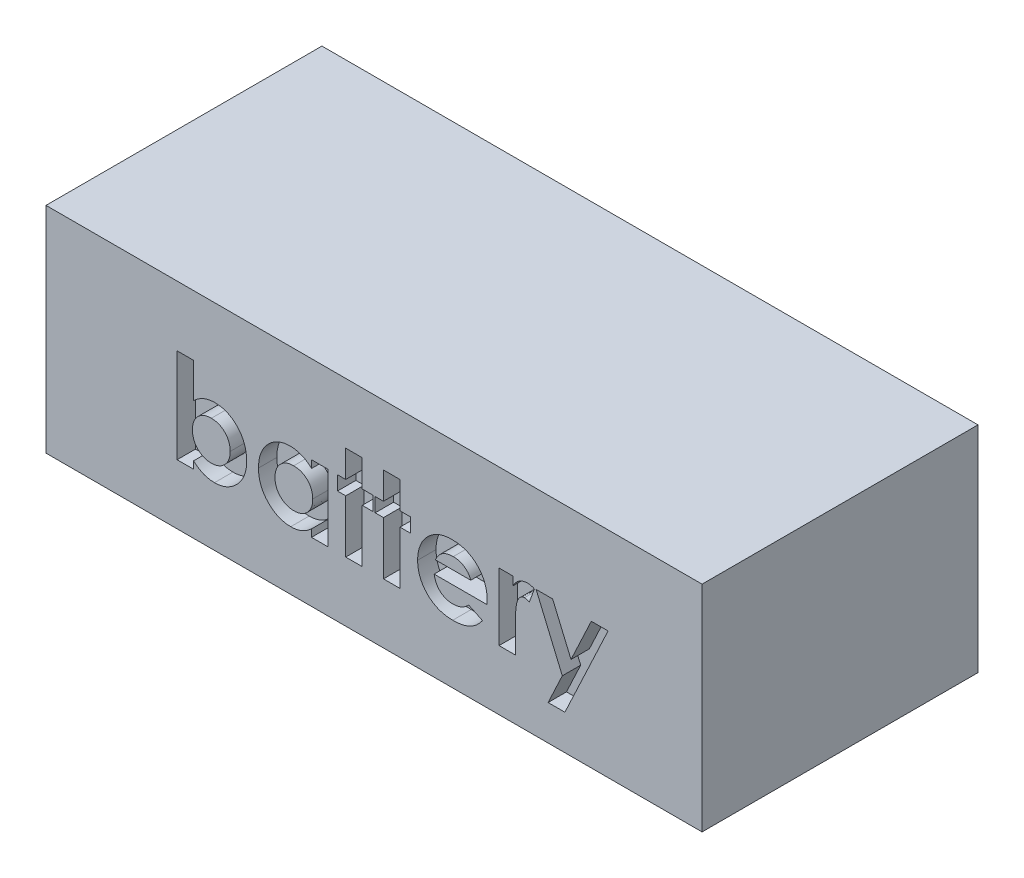
from build123d import *

# Parameters (mm, degrees)
SKETCH_1_W          = 107
SKETCH_1_H          = 35
EXTRUDE_1_DEPTH     = 45
CUT_EXTRUDE_1_DEPTH = 3


with BuildPart() as part:
    # ｽｹｯﾁ1 → ﾎﾞｽ - 押し出し1 (new body)
    with BuildSketch(Plane.XY):
        with Locations((53.5, 17.5)):
            Rectangle(SKETCH_1_W, SKETCH_1_H)
    extrude(amount=EXTRUDE_1_DEPTH)

    # ｽｹｯﾁ2 → ｶｯﾄ - 押し出し1 (cut)
    # profile 1 of 7: a face of its own
    with BuildSketch(Plane.XY.offset(45)):
        with BuildLine():
            Line((24.074722229, 25.14774532), (24.074722229, 19.447625128))
            add(Edge.make_bspline(
                [(24.074722229, 19.447625128), (24.199740685, 19.565337539), (24.445158571, 19.79641327), (24.845857096, 20.095219483), (25.260933041, 20.347409477), (25.690014561, 20.558985084), (26.136963428, 20.715436123), (26.596288067, 20.837004441), (27.072695046, 20.901389585), (27.394868954, 20.911751888), (27.557294345, 20.916976089)],
                knots=[0, 0, 0, 0, 1.061187343, 2.083167259, 3.083809127, 4.061667593, 5.035358583, 6.007314429, 6.995378812, 8, 8, 8, 8], degree=3))
            add(Edge.make_bspline(
                [(27.557294345, 20.916976089), (27.733852947, 20.912747065), (28.081616104, 20.904417261), (28.59328342, 20.826646571), (29.083624154, 20.700935602), (29.554508103, 20.525408828), (30.00342645, 20.297516625), (30.435423114, 20.024658742), (30.843047804, 19.695575564), (31.226498678, 19.322833687), (31.581200289, 18.914280901), (31.889725368, 18.470097312), (32.146714786, 17.996129229), (32.364525944, 17.497979945), (32.523493276, 16.967387819), (32.646012031, 16.41147039), (32.714286357, 15.825524477), (32.723746, 15.426355734), (32.728568383, 15.222865512)],
                knots=[0, 0, 0, 0, 0.985987466, 1.942075377, 2.884088208, 3.810275091, 4.743821533, 5.692411115, 6.659945104, 7.665215984, 8.677116751, 9.678438675, 10.680260931, 11.685531812, 12.710472044, 13.769734641, 14.863044265, 16, 16, 16, 16], degree=3))
            add(Edge.make_bspline(
                [(32.728568383, 15.222865512), (32.724004319, 15.026341303), (32.715007541, 14.638948756), (32.642319248, 14.07022462), (32.519118679, 13.526931847), (32.346293248, 13.008874775), (32.126585563, 12.514416254), (31.858417169, 12.043896993), (31.540223782, 11.598960505), (31.176446629, 11.185600535), (30.778967225, 10.811272353), (30.364822177, 10.47542555), (29.925763077, 10.200225432), (29.472765421, 9.967797849), (28.99869278, 9.790064974), (28.506783278, 9.665543118), (27.997815979, 9.582292533), (27.651780207, 9.574683754), (27.476164537, 9.570822243)],
                knots=[0, 0, 0, 0, 1.098553145, 2.165490463, 3.199345634, 4.208780719, 5.21409072, 6.219899742, 7.23156933, 8.267303578, 9.293302409, 10.281606823, 11.243293419, 12.184993323, 13.124258899, 14.066907486, 15.018941492, 16, 16, 16, 16], degree=3))
            add(Edge.make_bspline(
                [(27.476164537, 9.570822243), (27.319730468, 9.575004139), (27.011700412, 9.583238596), (26.557651289, 9.644311662), (26.121326568, 9.747024792), (25.697214428, 9.888512791), (25.284164117, 10.081826998), (24.874982354, 10.323541124), (24.467035734, 10.616713412), (24.208125782, 10.842636401), (24.074722229, 10.959043397)],
                knots=[0, 0, 0, 0, 0.996418773, 1.962021009, 2.912343664, 3.848616743, 4.805003894, 5.811808768, 6.872532775, 8, 8, 8, 8], degree=3))
            Line((24.074722229, 10.959043397), (24.074722229, 9.763129935))
            Line((24.074722229, 9.763129935), (21.382414537, 9.763129935))
            Line((21.382414537, 9.763129935), (21.382414537, 25.14774532))
            Line((21.382414537, 25.14774532), (24.074722229, 25.14774532))
        make_face()
        with BuildLine():
            add(Edge.make_bspline(
                [(26.974361653, 18.416976089), (26.865099774, 18.413616211), (26.650887096, 18.407029024), (26.33638387, 18.369277884), (26.038386525, 18.298248837), (25.752364254, 18.20618792), (25.481938922, 18.081920142), (25.224898143, 17.931282049), (24.983443495, 17.751657623), (24.756321835, 17.550159769), (24.552234967, 17.323474304), (24.370921489, 17.081249127), (24.220497806, 16.820330011), (24.095103271, 16.544025378), (24.000498573, 16.249345641), (23.930329296, 15.938797645), (23.892196742, 15.611429699), (23.885726844, 15.388220613), (23.882414537, 15.273947243)],
                knots=[0, 0, 0, 0, 1.060469436, 2.079096586, 3.066888298, 4.028858836, 4.99004353, 5.948472697, 6.914558426, 7.905691313, 8.889602648, 9.869280844, 10.836099585, 11.806137001, 12.808075328, 13.83377171, 14.890985086, 16, 16, 16, 16], degree=3))
            add(Edge.make_bspline(
                [(23.882414537, 15.273947243), (23.885768523, 15.157673996), (23.892350864, 14.929482742), (23.930165535, 14.595134114), (23.999842295, 14.278364407), (24.096439546, 13.978455425), (24.219700324, 13.695368255), (24.369945783, 13.428053453), (24.553255054, 13.182371758), (24.755099952, 12.949709575), (24.983625962, 12.745515637), (25.223992851, 12.562381763), (25.481876475, 12.411519127), (25.753594179, 12.289284732), (26.037084193, 12.187708619), (26.336571059, 12.119073744), (26.650837426, 12.080622492), (26.865082997, 12.07413253), (26.974361653, 12.070822243)],
                knots=[0, 0, 0, 0, 1.117193555, 2.192540452, 3.22680955, 4.227918444, 5.21468246, 6.188555072, 7.166222992, 8.154674427, 9.142376254, 10.104580718, 11.053462639, 12.005072638, 12.963662044, 13.941614018, 14.950094269, 16, 16, 16, 16], degree=3))
            add(Edge.make_bspline(
                [(26.974361653, 12.070822243), (27.079665331, 12.073897398), (27.288106209, 12.079984442), (27.593090526, 12.122457697), (27.886256438, 12.191863216), (28.165308067, 12.290791188), (28.43194411, 12.419595308), (28.688591945, 12.570317446), (28.926391124, 12.758633506), (29.154670906, 12.965608932), (29.358920323, 13.199017685), (29.542156597, 13.446983743), (29.696080512, 13.711720254), (29.818292473, 13.994105123), (29.919328586, 14.28878957), (29.988309127, 14.60116734), (30.026260957, 14.928450238), (30.032894331, 15.151657649), (30.036260691, 15.26493282)],
                knots=[0, 0, 0, 0, 1.021711385, 2.02240246, 2.981887075, 3.941027022, 4.888772411, 5.852236371, 6.822344989, 7.82661704, 8.838806642, 9.826383926, 10.814965113, 11.80282933, 12.807900643, 13.833672313, 14.900613836, 16, 16, 16, 16], degree=3))
            add(Edge.make_bspline(
                [(30.036260691, 15.26493282), (30.032840572, 15.377188896), (30.026101979, 15.598364795), (29.988927322, 15.922922302), (29.917290925, 16.230758637), (29.826840855, 16.524388597), (29.700473999, 16.799989885), (29.551057934, 17.060822821), (29.37524225, 17.30767497), (29.171288482, 17.533882533), (28.947587146, 17.739715164), (28.708789779, 17.921775824), (28.455834161, 18.076761318), (28.185275591, 18.198984936), (27.903498823, 18.299548632), (27.606197721, 18.368818236), (27.294883736, 18.40715591), (27.082637311, 18.413658731), (26.974361653, 18.416976089)],
                knots=[0, 0, 0, 0, 1.094680664, 2.156827393, 3.177782763, 4.17210342, 5.146667393, 6.126451192, 7.099203661, 8.094961544, 9.09004898, 10.058676268, 11.018205477, 11.974998356, 12.947750825, 13.930643515, 14.944335875, 16, 16, 16, 16], degree=3))
        make_face(mode=Mode.SUBTRACT)
    # profile 2 of 7: a face of its own
    with BuildSketch(Plane.XY.offset(45)):
        with BuildLine():
            Line((43.30549146, 20.724668397), (45.997799153, 20.724668397))
            Line((45.997799153, 20.724668397), (45.997799153, 9.763129935))
            Line((45.997799153, 9.763129935), (43.30549146, 9.763129935))
            Line((43.30549146, 9.763129935), (43.30549146, 10.959043397))
            add(Edge.make_bspline(
                [(43.30549146, 10.959043397), (43.172088606, 10.842634457), (42.91318001, 10.616707694), (42.505223842, 10.323561975), (42.096075578, 10.081754643), (41.683769251, 9.88916829), (41.261967884, 9.74696309), (40.827634678, 9.644003204), (40.374514772, 9.58328524), (40.066490102, 9.575019849), (39.910058768, 9.570822243)],
                knots=[0, 0, 0, 0, 1.129196829, 2.191548051, 3.199897424, 4.157751732, 5.089409408, 6.034969131, 7.002052659, 8, 8, 8, 8], degree=3))
            add(Edge.make_bspline(
                [(39.910058768, 9.570822243), (39.734457642, 9.574772719), (39.387459864, 9.582579084), (38.878279148, 9.664753667), (38.386614546, 9.790540183), (37.912865152, 9.968543825), (37.457892911, 10.199201648), (37.018215905, 10.476495468), (36.601371537, 10.810159956), (36.203889722, 11.1857583), (35.839957755, 11.598919151), (35.521804995, 12.043907893), (35.253625863, 12.514413342), (35.033921051, 13.008875558), (34.861094844, 13.526931632), (34.737894488, 14.07022468), (34.665206137, 14.638948741), (34.656209367, 15.026341298), (34.651645306, 15.222865512)],
                knots=[0, 0, 0, 0, 0.980476535, 1.937477201, 2.874147792, 3.812856188, 4.758993464, 5.720109578, 6.712210464, 7.737600662, 8.772720504, 9.783789959, 10.789002326, 11.793715968, 12.802552247, 13.835794126, 14.902098527, 16, 16, 16, 16], degree=3))
            add(Edge.make_bspline(
                [(34.651645306, 15.222865512), (34.656435305, 15.426366594), (34.665831421, 15.825556642), (34.734563449, 16.411349057), (34.855490294, 16.968113012), (35.02038274, 17.496619706), (35.23248824, 17.996960444), (35.490818566, 18.469954945), (35.798888061, 18.914366876), (36.153883542, 19.322632035), (36.537191469, 19.696826773), (36.947263189, 20.022592967), (37.377686076, 20.299346506), (37.82891753, 20.525284794), (38.300893112, 20.699878468), (38.791749471, 20.827520701), (39.303665663, 20.904110523), (39.652387121, 20.912651952), (39.82892896, 20.916976089)],
                knots=[0, 0, 0, 0, 1.136281865, 2.228943489, 3.287578264, 4.313574083, 5.316051562, 6.317280042, 7.318008486, 8.329309503, 9.333984563, 10.305318864, 11.248632312, 12.186624717, 13.117503092, 14.05354244, 15.014596925, 16, 16, 16, 16], degree=3))
            add(Edge.make_bspline(
                [(39.82892896, 20.916976089), (39.992463906, 20.913578616), (40.316040619, 20.906856243), (40.791651764, 20.833864127), (41.252925978, 20.723468735), (41.697346987, 20.566175173), (42.128560078, 20.367560051), (42.539148116, 20.118680498), (42.938093084, 19.829996812), (43.18151224, 19.604528738), (43.30549146, 19.489692435)],
                knots=[0, 0, 0, 0, 1.017011718, 2.012299608, 2.98747302, 3.965332399, 4.941441765, 5.936729654, 6.94912688, 8, 8, 8, 8], degree=3))
            Line((43.30549146, 19.489692435), (43.30549146, 20.724668397))
        make_face()
        with BuildLine():
            add(Edge.make_bspline(
                [(40.393832806, 18.416976089), (40.286552281, 18.413684352), (40.076289457, 18.407232763), (39.767069199, 18.368426004), (39.471547394, 18.300046764), (39.191831682, 18.199031122), (38.923753269, 18.075979352), (38.671382969, 17.921859035), (38.432637894, 17.739692096), (38.208922127, 17.533888793), (38.004972244, 17.307673336), (37.829155541, 17.060823258), (37.679739748, 16.799989768), (37.553372819, 16.524388629), (37.462922769, 16.230758628), (37.391286367, 15.922922305), (37.354111711, 15.598364794), (37.347373118, 15.377188896), (37.343952999, 15.26493282)],
                knots=[0, 0, 0, 0, 1.04836806, 2.054732945, 3.03993516, 4.00574415, 4.955904794, 5.917688631, 6.888591924, 7.88601754, 8.884115178, 9.859153345, 10.841239365, 11.818093293, 12.814750328, 13.83810466, 14.90274714, 16, 16, 16, 16], degree=3))
            add(Edge.make_bspline(
                [(37.343952999, 15.26493282), (37.347320875, 15.151658516), (37.353957236, 14.928452815), (37.391887445, 14.601157546), (37.460946074, 14.288824457), (37.561700009, 13.993978549), (37.684743936, 13.712641376), (37.834516065, 13.446111335), (38.018484893, 13.199101011), (38.222613561, 12.965765309), (38.450918821, 12.757405584), (38.691014813, 12.572401277), (38.946181058, 12.417608292), (39.213649182, 12.292503623), (39.492518876, 12.190553833), (39.78628632, 12.123033981), (40.092073692, 12.079869817), (40.300537018, 12.073858926), (40.405852037, 12.070822243)],
                knots=[0, 0, 0, 0, 1.099136573, 2.165835871, 3.191374663, 4.196217796, 5.183857741, 6.167377911, 7.154730987, 8.166690795, 9.170734848, 10.148332609, 11.103258353, 12.059567475, 13.009337315, 13.978056681, 14.978520572, 16, 16, 16, 16], degree=3))
            add(Edge.make_bspline(
                [(40.405852037, 12.070822243), (40.515130787, 12.074132434), (40.729376544, 12.080622208), (41.043641574, 12.119074814), (41.343133296, 12.187704772), (41.626605664, 12.289298751), (41.898388449, 12.411467253), (42.156029055, 12.562575941), (42.396731692, 12.744324857), (42.621715411, 12.951988628), (42.827869618, 13.180051271), (43.006117727, 13.430138395), (43.161378351, 13.694251527), (43.283483688, 13.978635265), (43.380452449, 14.278314221), (43.450025299, 14.595148265), (43.487868896, 14.929478984), (43.494447216, 15.157672727), (43.497799153, 15.273947243)],
                knots=[0, 0, 0, 0, 1.050008698, 2.058587853, 3.036635738, 3.995319155, 4.947022481, 5.895997462, 6.858296291, 7.838991643, 8.833936038, 9.806048392, 10.784806122, 11.771666913, 12.772873988, 13.80724452, 14.882696879, 16, 16, 16, 16], degree=3))
            add(Edge.make_bspline(
                [(43.497799153, 15.273947243), (43.494488867, 15.388221892), (43.488022917, 15.611433478), (43.44986209, 15.938783529), (43.379795312, 16.249396399), (43.284822328, 16.543843036), (43.160544699, 16.82145019), (43.005166601, 17.07913986), (42.828873771, 17.325840028), (42.620437139, 17.547741436), (42.396672209, 17.753901562), (42.152429648, 17.930154258), (41.895404425, 18.082053724), (41.624017371, 18.206769042), (41.335755564, 18.298190099), (41.03575203, 18.368974078), (40.719326093, 18.407209472), (40.504101129, 18.413667423), (40.393832806, 18.416976089)],
                knots=[0, 0, 0, 0, 1.106611376, 2.161533483, 3.185006901, 4.184773755, 5.152708835, 6.122342771, 7.094156588, 8.082475533, 9.064254463, 10.03606828, 10.992420271, 11.951521816, 12.920622147, 13.915721683, 14.932141191, 16, 16, 16, 16], degree=3))
        make_face(mode=Mode.SUBTRACT)
    # profile 3 of 7: a face of its own
    with BuildSketch(Plane.XY.offset(45)):
        Polygon((48.882414537, 25.14774532), (51.574722229, 25.14774532), (51.574722229, 20.724668397), (53.30549146, 20.724668397), (53.30549146, 18.416976089), (51.574722229, 18.416976089), (51.574722229, 9.763129935), (48.882414537, 9.763129935), (48.882414537, 18.416976089), (47.536260691, 18.416976089), (47.536260691, 20.724668397), (48.882414537, 20.724668397), align=None)
    # profile 4 of 7: a face of its own
    with BuildSketch(Plane.XY.offset(45)):
        Polygon((55.036260691, 25.14774532), (57.728568383, 25.14774532), (57.728568383, 20.724668397), (59.459337614, 20.724668397), (59.459337614, 18.416976089), (57.728568383, 18.416976089), (57.728568383, 9.763129935), (55.036260691, 9.763129935), (55.036260691, 18.416976089), (53.690106845, 18.416976089), (53.690106845, 20.724668397), (55.036260691, 20.724668397), align=None)
    # profile 5 of 7: a face of its own
    with BuildSketch(Plane.XY.offset(45)):
        with BuildLine():
            Line((71.950323191, 14.570822243), (63.30549146, 14.570822243))
            add(Edge.make_bspline(
                [(63.30549146, 14.570822243), (63.323117574, 14.470374203), (63.357754278, 14.272985878), (63.432969113, 13.98626221), (63.528954523, 13.716058664), (63.643986992, 13.462014045), (63.776127073, 13.222785319), (63.930257531, 12.999494561), (64.10442336, 12.792338999), (64.29761758, 12.60221895), (64.506619995, 12.431867266), (64.73041702, 12.282628421), (64.969239598, 12.160261698), (65.220349721, 12.057119249), (65.485623757, 11.975419979), (65.765452124, 11.919073547), (66.059093039, 11.885789503), (66.2591302, 11.880975347), (66.361380883, 11.878514551)],
                knots=[0, 0, 0, 0, 1.091296461, 2.144483647, 3.168565212, 4.157007626, 5.126487748, 6.090021542, 7.05641414, 8.019231907, 8.98705074, 9.938580405, 10.892824166, 11.854447369, 12.841318655, 13.858982407, 14.905600794, 16, 16, 16, 16], degree=3))
            add(Edge.make_bspline(
                [(66.361380883, 11.878514551), (66.484804399, 11.881773051), (66.727861648, 11.888189997), (67.083942328, 11.945098779), (67.428324215, 12.031056992), (67.757748243, 12.158884071), (68.076030272, 12.318006314), (68.377930402, 12.516253049), (68.668674288, 12.74783086), (68.846062322, 12.926330947), (68.936501076, 13.017336666)],
                knots=[0, 0, 0, 0, 1.021034703, 2.010718019, 2.977989445, 3.954245119, 4.929443971, 5.918328161, 6.938689359, 8, 8, 8, 8], degree=3))
            Line((68.936501076, 13.017336666), (71.190106845, 11.94462032))
            add(Edge.make_bspline(
                [(71.190106845, 11.94462032), (71.119153382, 11.846573525), (70.978561706, 11.652297405), (70.749050513, 11.37890073), (70.509540968, 11.123810541), (70.259854446, 10.888704605), (69.999674282, 10.674252881), (69.729724234, 10.477842959), (69.446059093, 10.304748368), (69.154350691, 10.146594895), (68.848568877, 10.011010657), (68.529559885, 9.895389204), (68.198674894, 9.790868394), (67.851735545, 9.711229263), (67.491630796, 9.648187576), (67.117499208, 9.603419627), (66.729390088, 9.57576861), (66.465594581, 9.572490616), (66.331332806, 9.570822243)],
                knots=[0, 0, 0, 0, 1.028154879, 2.037251081, 3.030720504, 4.000128189, 4.949298328, 5.894184978, 6.834267904, 7.770992897, 8.712077017, 9.673380525, 10.653304757, 11.658697181, 12.695551717, 13.758623199, 14.859225354, 16, 16, 16, 16], degree=3))
            add(Edge.make_bspline(
                [(66.331332806, 9.570822243), (66.124773271, 9.57503337), (65.720238326, 9.583280621), (65.12853284, 9.659826908), (64.566576745, 9.786748904), (64.032783271, 9.959279863), (63.52945983, 10.18707478), (63.056357326, 10.46568686), (62.608748788, 10.789774551), (62.200311156, 11.166139592), (61.828212423, 11.575790563), (61.501384032, 12.015727733), (61.227898688, 12.482877426), (61.003307023, 12.974147949), (60.828746579, 13.49079676), (60.702898624, 14.033049316), (60.62575232, 14.600646626), (60.617420136, 14.987243754), (60.613183768, 15.183803012)],
                knots=[0, 0, 0, 0, 1.103565453, 2.161269334, 3.182010356, 4.179077853, 5.15417608, 6.128274628, 7.109042802, 8.101804412, 9.090965879, 10.063106201, 11.02526161, 11.978650795, 12.945248442, 13.93468508, 14.949922959, 16, 16, 16, 16], degree=3))
            add(Edge.make_bspline(
                [(60.613183768, 15.183803012), (60.617461831, 15.385357093), (60.625878728, 15.781905696), (60.702234395, 16.362609087), (60.829094506, 16.916678666), (61.004165577, 17.444877445), (61.225350159, 17.948857403), (61.502315134, 18.424209319), (61.828050236, 18.87258811), (62.198808491, 19.291896216), (62.60897639, 19.670367591), (63.044818535, 20.007661221), (63.511232059, 20.288716662), (64.002941423, 20.515809284), (64.516801476, 20.700316307), (65.058751723, 20.823090321), (65.624668749, 20.905525723), (66.011517165, 20.913117509), (66.208135691, 20.916976089)],
                knots=[0, 0, 0, 0, 1.079208495, 2.12329425, 3.130605359, 4.119693003, 5.099659317, 6.073216462, 7.060498243, 8.06384408, 9.066070512, 10.045757761, 11.010926815, 11.975797609, 12.942977511, 13.929384301, 14.947594487, 16, 16, 16, 16], degree=3))
            add(Edge.make_bspline(
                [(66.208135691, 20.916976089), (66.415684787, 20.912699629), (66.823186047, 20.904303241), (67.419012579, 20.828378491), (67.984699995, 20.700682541), (68.522658441, 20.529643424), (69.026017967, 20.296094169), (69.505838907, 20.024338291), (69.950612435, 19.693245198), (70.365079363, 19.318721967), (70.739220471, 18.903201421), (71.066261255, 18.451818843), (71.344532711, 17.968979463), (71.570074487, 17.452725263), (71.744455689, 16.904606089), (71.870420139, 16.325333782), (71.946978001, 15.712705067), (71.955155142, 15.293203075), (71.959337614, 15.078634743)],
                knots=[0, 0, 0, 0, 1.080001299, 2.120471247, 3.119684163, 4.095710327, 5.052285597, 6.002875087, 6.961153713, 7.931888285, 8.906493152, 9.865905668, 10.82813294, 11.801621613, 12.7925306, 13.817193356, 14.883530496, 16, 16, 16, 16], degree=3))
            Line((71.959337614, 15.078634743), (71.950323191, 14.570822243))
        make_face()
        with BuildLine():
            add(Edge.make_bspline(
                [(69.267029922, 16.686206858), (69.216224429, 16.823310303), (69.115209874, 17.095907667), (68.8870222, 17.472025514), (68.584224456, 17.797758846), (68.232048958, 18.086133147), (67.8296664, 18.320195743), (67.38975656, 18.489664664), (66.917879815, 18.591280356), (66.593254042, 18.603198091), (66.427486653, 18.609283781)],
                knots=[0, 0, 0, 0, 0.954238005, 1.897273737, 2.851915805, 3.847685534, 4.862635127, 5.880135777, 6.917509367, 8, 8, 8, 8], degree=3))
            add(Edge.make_bspline(
                [(66.427486653, 18.609283781), (66.246441674, 18.603437735), (65.892536438, 18.592009932), (65.38205223, 18.470471047), (64.900525251, 18.289077892), (64.616644236, 18.102057698), (64.474361653, 18.008322243)],
                knots=[0, 0, 0, 0, 1.044195649, 2.041185066, 3.018232172, 4, 4, 4, 4], degree=3))
            add(Edge.make_bspline(
                [(64.474361653, 18.008322243), (64.385587947, 17.936931267), (64.196326946, 17.784729356), (63.950533139, 17.481100993), (63.708424193, 17.113475206), (63.570771909, 16.834237448), (63.497799153, 16.686206858)],
                knots=[0, 0, 0, 0, 0.82159062, 1.751589201, 2.808063854, 4, 4, 4, 4], degree=3))
            Line((63.497799153, 16.686206858), (69.267029922, 16.686206858))
        make_face(mode=Mode.SUBTRACT)
    # profile 6 of 7: a face of its own
    with BuildSketch(Plane.XY.offset(45)):
        with BuildLine():
            Line((73.882414537, 20.724668397), (76.190106845, 20.724668397))
            Line((76.190106845, 20.724668397), (76.190106845, 19.375509743))
            add(Edge.make_bspline(
                [(76.190106845, 19.375509743), (76.25538703, 19.495409844), (76.38297986, 19.729759565), (76.617378591, 20.044327657), (76.886665345, 20.309248127), (77.181163819, 20.530062028), (77.501766579, 20.702164783), (77.839888455, 20.824809692), (78.192636819, 20.904511888), (78.433269795, 20.912791439), (78.554890499, 20.916976089)],
                knots=[0, 0, 0, 0, 1.09866127, 2.147379032, 3.14564304, 4.131443017, 5.102343063, 6.064490016, 7.021754664, 8, 8, 8, 8], degree=3))
            add(Edge.make_bspline(
                [(78.554890499, 20.916976089), (78.643202305, 20.91284078), (78.823036678, 20.904419815), (79.097129568, 20.855468618), (79.375177137, 20.766955545), (79.558156397, 20.687261286), (79.651645306, 20.646543397)],
                knots=[0, 0, 0, 0, 0.931404136, 1.896671404, 2.925354185, 4, 4, 4, 4], degree=3))
            Line((79.651645306, 20.646543397), (78.816308768, 18.365894358))
            add(Edge.make_bspline(
                [(78.816308768, 18.365894358), (78.74164161, 18.401969919), (78.601296096, 18.469778085), (78.397538779, 18.549798707), (78.212620566, 18.59862338), (78.095385813, 18.605908449), (78.041068383, 18.609283781)],
                knots=[0, 0, 0, 0, 1.214386998, 2.282580073, 3.20428172, 4, 4, 4, 4], degree=3))
            add(Edge.make_bspline(
                [(78.041068383, 18.609283781), (77.989782167, 18.607047108), (77.888893342, 18.602647186), (77.73998426, 18.56494135), (77.599742913, 18.499918804), (77.461411078, 18.416618469), (77.335901604, 18.300824774), (77.210469655, 18.166773011), (77.099932305, 18.001268281), (76.983283343, 17.81705311), (76.883960924, 17.591573907), (76.798795007, 17.322398204), (76.722911492, 17.006411455), (76.670693273, 16.641935922), (76.620222267, 16.232498537), (76.590180686, 15.77509408), (76.567790315, 15.271168907), (76.566421294, 14.91941095), (76.565707806, 14.736086666)],
                knots=[0, 0, 0, 0, 0.544232178, 1.070598461, 1.618251235, 2.182094276, 2.777567932, 3.425210017, 4.127676488, 4.886675562, 5.738955394, 6.734782583, 7.883056018, 9.186093582, 10.642914445, 12.264202625, 14.053029461, 16, 16, 16, 16], degree=3))
            Line((76.565707806, 14.736086666), (76.574722229, 14.201230897))
            Line((76.574722229, 14.201230897), (76.574722229, 9.763129935))
            Line((76.574722229, 9.763129935), (73.882414537, 9.763129935))
            Line((73.882414537, 9.763129935), (73.882414537, 20.724668397))
        make_face()
    # profile 7 of 7: a face of its own
    with BuildSketch(Plane.XY.offset(45)):
        Polygon((79.934097229, 20.724668397), (82.629409729, 20.724668397), (85.622198191, 13.672384743), (88.933496268, 20.724668397), (91.670876076, 20.724668397), (84.624602037, 5.724668397), (81.887222229, 5.724668397), (84.20392896, 10.65555782), align=None)
    extrude(amount=-CUT_EXTRUDE_1_DEPTH, mode=Mode.SUBTRACT)


solid = part.part
